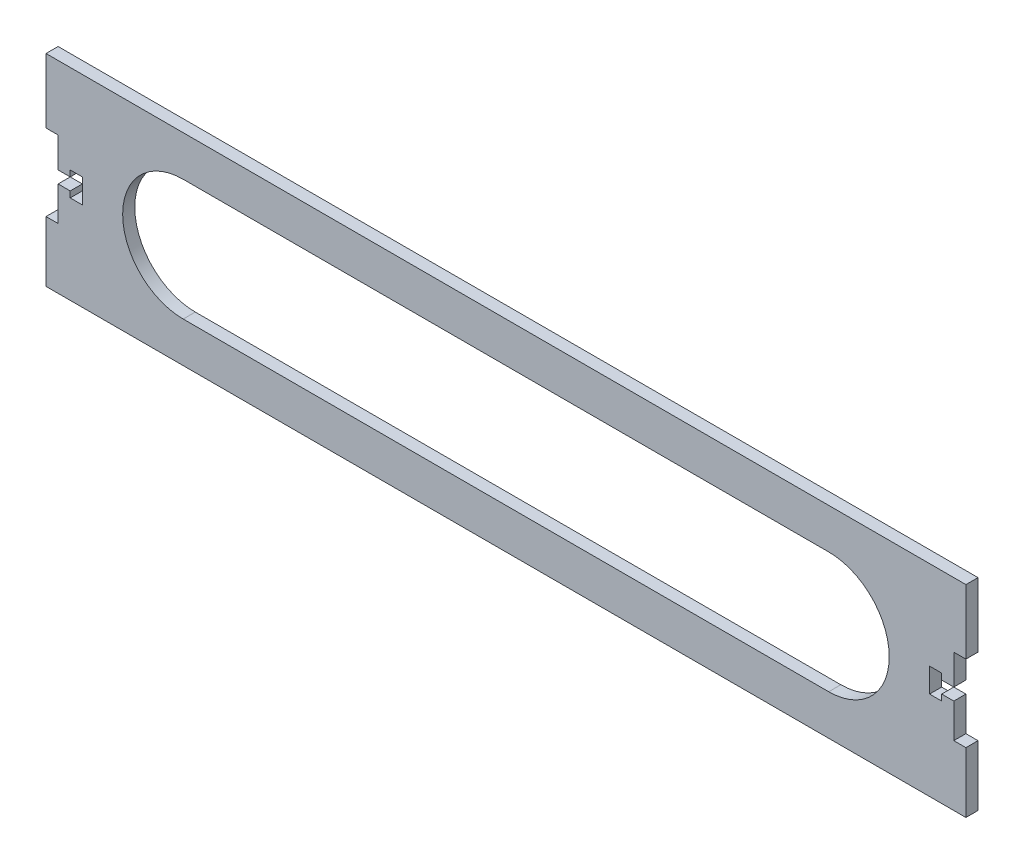
from build123d import *

# Parameters (mm, degrees)
SALIENTE_EXTRUIR1_DEPTH = 3
CROQUIS2_W              = 3
CROQUIS2_H              = 16
CROQUIS2_H_2            = 15
SALIENTE_EXTRUIR2_DEPTH = 3


with BuildPart() as part:
    # Croquis1 → Saliente-Extruir1 (new body)
    with BuildSketch(Plane.XY):
        Polygon((111, -25), (-111, -25), (-111, -1.5), (-108, -1.5), (-108, -3), (-105, -3), (-105, 3), (-108, 3), (-108, 1.5), (-111, 1.5), (-111, 25), (111, 25), (111, 1.5), (108, 1.5), (108, 3), (105, 3), (105, -3), (108, -3), (108, -1.5), (111, -1.5), align=None)
        with BuildLine():
            Line((80, -15), (-80, -15))
            ThreePointArc((-80, -15), (-95, 0), (-80, 15))
            Line((-80, 15), (80, 15))
            ThreePointArc((80, 15), (95, 0), (80, -15))
        make_face(mode=Mode.SUBTRACT)
    extrude(amount=SALIENTE_EXTRUIR1_DEPTH)

    # Croquis2 → Saliente-Extruir2 (add)
    with BuildSketch(Plane.ZY.offset(111)):
        with Locations((1.5, 17)):
            Rectangle(CROQUIS2_W, CROQUIS2_H)
        with Locations((1.5, -17.5)):
            Rectangle(CROQUIS2_W, CROQUIS2_H_2)
    saliente_extruir2 = extrude(amount=SALIENTE_EXTRUIR2_DEPTH)

    # Simetría1: Saliente-Extruir2 across plane
    add(saliente_extruir2.mirror(Plane(origin=(0, 0, 0), x_dir=(0, 0, 1), z_dir=(1, 0, 0))))


solid = part.part
